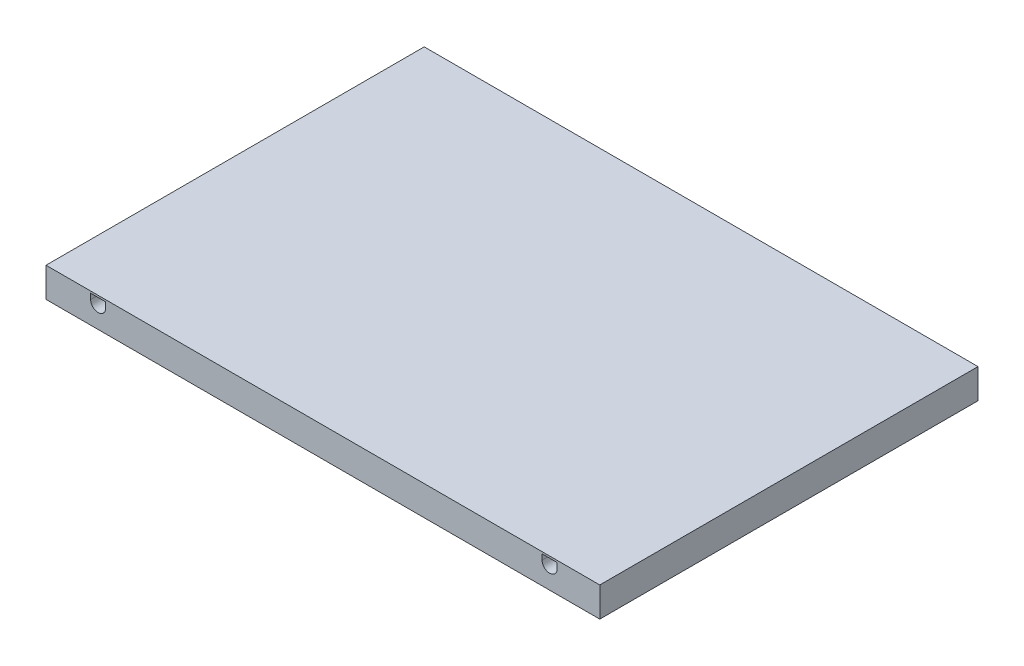
from build123d import *

# Parameters (mm, degrees)
SKETCH1_W           = 233.675
SKETCH1_H           = 159.601
BOSS_EXTRUDE1_DEPTH = 12.5


with BuildPart() as part:
    # Sketch1 → Boss-Extrude1 (new body)
    with BuildSketch(Plane(origin=(0, 0, 0), x_dir=(1, 0, 0), z_dir=(0, 1, 0))):
        Rectangle(SKETCH1_W, SKETCH1_H)
    extrude(amount=BOSS_EXTRUDE1_DEPTH)

    # Cut-Sweep1: sweep along a path in Sketch2
    with BuildLine(Plane(origin=(0, 12.5, 0), x_dir=(1, 0, 0), z_dir=(0, 1, 0))) as cut_sweep1_path:
        Line((-94.8375, -79.8005), (-94.8375, 45.7505))
        ThreePointArc((-94.8375, 45.7505), (-75.7875, 64.8005), (-56.7375, 45.7505))
        Line((-56.7375, 45.7505), (-56.7375, -45.7505))
        ThreePointArc((-56.7375, -45.7505), (-37.6875, -64.8005), (-18.6375, -45.7505))
        Line((-18.6375, -45.7505), (-18.6375, 45.7505))
        ThreePointArc((-18.6375, 45.7505), (0.4125, 64.8005), (19.4625, 45.7505))
        Line((19.4625, 45.7505), (19.4625, -45.7505))
        ThreePointArc((19.4625, -45.7505), (38.5125, -64.8005), (57.5625, -45.7505))
        Line((57.5625, -45.7505), (57.5625, 45.7505))
        ThreePointArc((57.5625, 45.7505), (76.6125, 64.8005), (95.6625, 45.7505))
        Line((95.6625, 45.7505), (95.6625, -79.8005))
    # Sketch3 → Cut-Sweep1 (sweep, cut)
    with BuildSketch(Plane.XY.offset(79.8005)):
        with BuildLine():
            Line((-98.80625, 9.38342), (-98.80625, 12.5))
            Line((-98.80625, 12.5), (-90.86875, 12.5))
            Line((-90.86875, 12.5), (-90.86875, 9.38342))
            ThreePointArc((-90.86875, 9.38342), (-94.8375, 5.41467), (-98.80625, 9.38342))
        make_face()
    sweep(path=cut_sweep1_path.line, mode=Mode.SUBTRACT)

    # Sweep1: sweep along a path in Sketch2<3>
    with BuildLine(Plane(origin=(0, 12.5, 0), x_dir=(1, 0, 0), z_dir=(0, 1, 0))) as sweep1_path:
        Line((-94.8375, -79.8005), (-94.8375, 45.7505))
        ThreePointArc((-94.8375, 45.7505), (-75.7875, 64.8005), (-56.7375, 45.7505))
        Line((-56.7375, 45.7505), (-56.7375, -45.7505))
        ThreePointArc((-56.7375, -45.7505), (-37.6875, -64.8005), (-18.6375, -45.7505))
        Line((-18.6375, -45.7505), (-18.6375, 45.7505))
        ThreePointArc((-18.6375, 45.7505), (0.4125, 64.8005), (19.4625, 45.7505))
        Line((19.4625, 45.7505), (19.4625, -45.7505))
        ThreePointArc((19.4625, -45.7505), (38.5125, -64.8005), (57.5625, -45.7505))
        Line((57.5625, -45.7505), (57.5625, 45.7505))
        ThreePointArc((57.5625, 45.7505), (76.6125, 64.8005), (95.6625, 45.7505))
        Line((95.6625, 45.7505), (95.6625, -79.8005))
    # Sketch4 → Sweep1 (sweep)
    with BuildSketch(Plane.XY.offset(79.8005)):
        with BuildLine():
            Line((-98.80625, 9.38342), (-98.80625, 12.5))
            Line((-98.80625, 12.5), (-90.86875, 12.5))
            Line((-90.86875, 12.5), (-90.86875, 9.38342))
            ThreePointArc((-90.86875, 9.38342), (-94.8375, 5.41467), (-98.80625, 9.38342))
        make_face()
        with BuildLine():
            Line((-98.0125, 9.38342), (-98.0125, 11.70625))
            Line((-98.0125, 11.70625), (-91.6625, 11.70625))
            Line((-91.6625, 11.70625), (-91.6625, 9.38342))
            ThreePointArc((-91.6625, 9.38342), (-94.8375, 6.20842), (-98.0125, 9.38342))
        make_face(mode=Mode.SUBTRACT)
    sweep(path=sweep1_path.line)


solid = part.part
